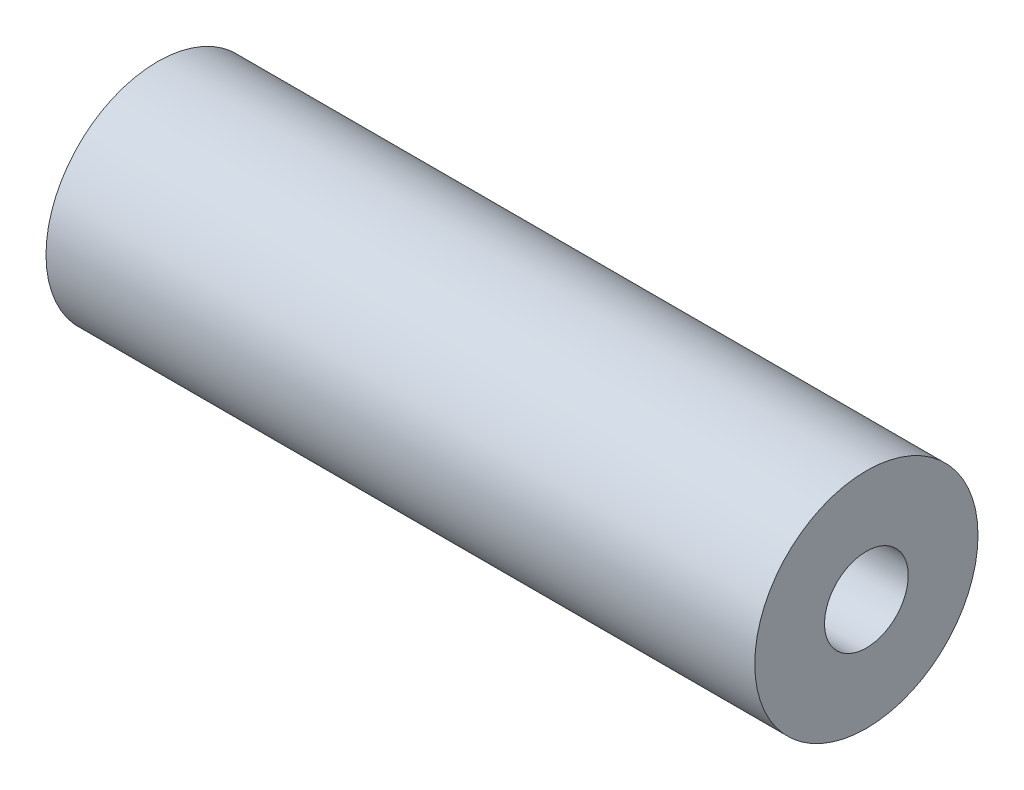
from build123d import *

# Parameters (mm, degrees)
SKETCH_1_R      = 4
SKETCH_1_R_2    = 1.5
EXTRUDE_1_DEPTH = 25.4


with BuildPart() as part:
    # ｽｹｯﾁ1 → ﾎﾞｽ - 押し出し1 (new body)
    with BuildSketch(Plane(origin=(0, 0, 0), x_dir=(0, 0, -1), z_dir=(1, 0, 0))):
        Circle(SKETCH_1_R)
        Circle(SKETCH_1_R_2, mode=Mode.SUBTRACT)
    extrude(amount=EXTRUDE_1_DEPTH)


solid = part.part
